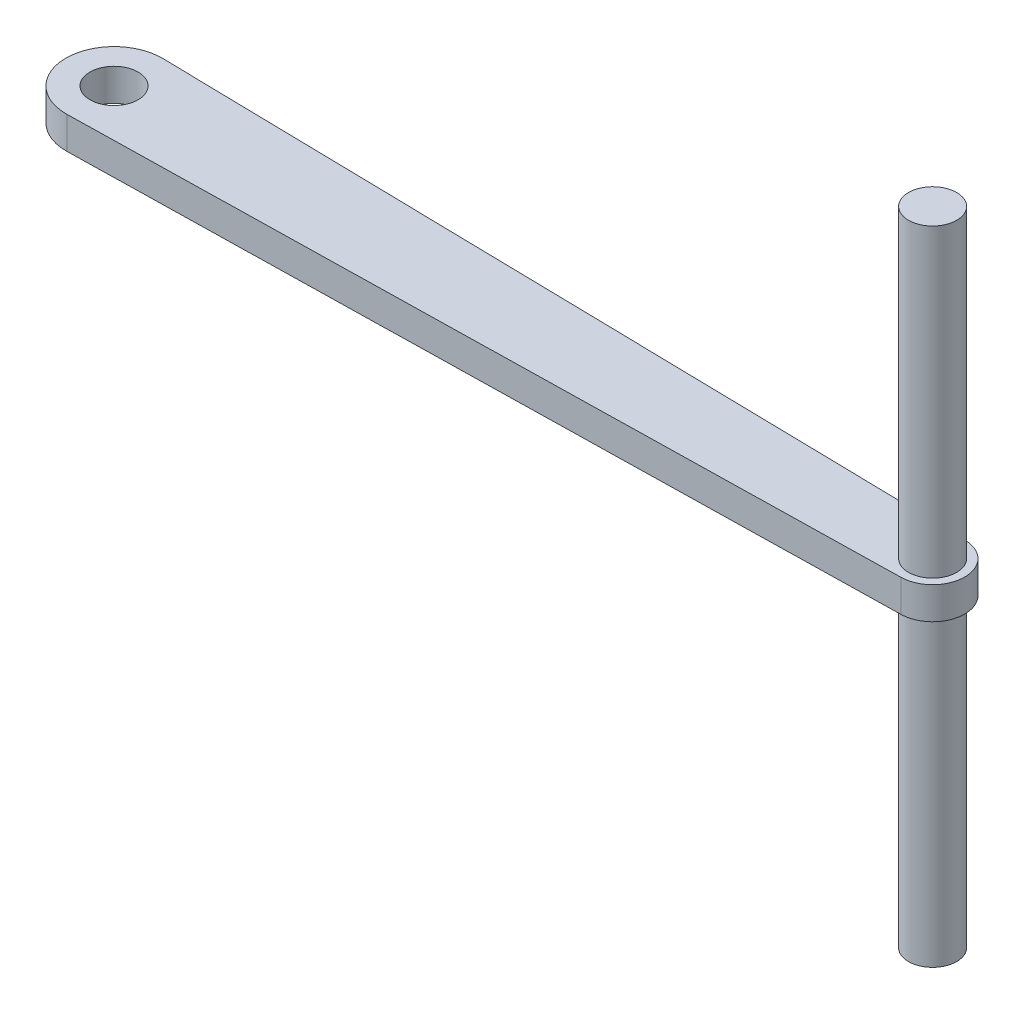
from build123d import *

# Parameters (mm, degrees)
SKETCH1_R           = 1.5
BOSS_EXTRUDE1_DEPTH = 20
SKETCH2_R           = 1.5
BOSS_EXTRUDE2_DEPTH = 1


with BuildPart() as part:
    # Sketch1 → Boss-Extrude1 (new, symmetric)
    with BuildSketch(Plane(origin=(0, 0, 0), x_dir=(1, 0, 0), z_dir=(0, 1, 0))):
        with Locations(Location((0, 0, 0), (0, 0, 270))):
            Circle(SKETCH1_R)
    extrude(amount=BOSS_EXTRUDE1_DEPTH, both=True)

    # Sketch2 → Boss-Extrude2 (add, symmetric)
    with BuildSketch(Plane(origin=(0, 0, 0), x_dir=(1, 0, 0), z_dir=(0, 1, 0))):
        with BuildLine():
            Line((-50.941176471, 2.999423243), (0.039215686, 1.999615496))
            ThreePointArc((0.039215686, 1.999615496), (2, 0), (0.039215686, -1.999615496))
            Line((0.039215686, -1.999615496), (-50.941176471, -2.999423243))
            ThreePointArc((-50.941176471, -2.999423243), (-54, 0), (-50.941176471, 2.999423243))
        make_face()
        with Locations(Location((-51, 0, 0), (0, 0, 270))):
            Circle(SKETCH2_R, mode=Mode.SUBTRACT)
    extrude(amount=BOSS_EXTRUDE2_DEPTH, both=True)


solid = part.part
